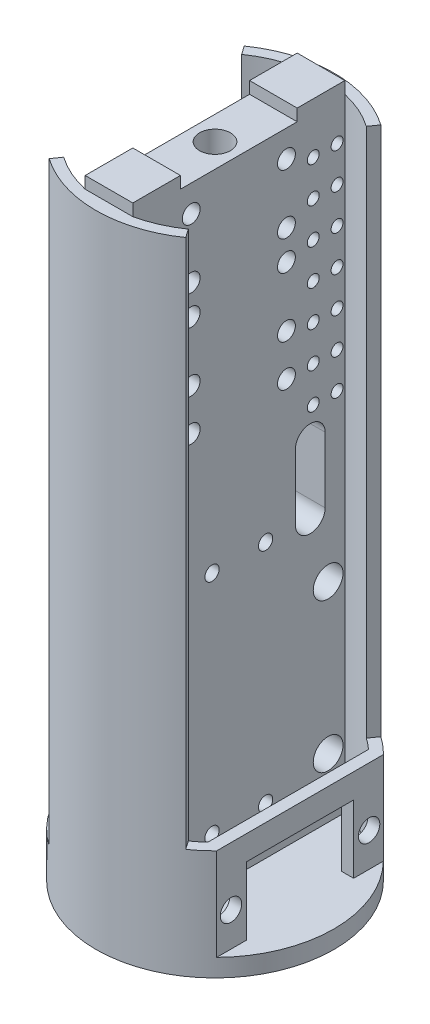
from build123d import *
from build123d.topology import SkipClean

# Parameters (mm, degrees)
SKETCH1_R            = 25.4
SKETCH1_R_2          = 3.302
BOTTOM_PLATE_DEPTH   = 3.81
LIP_START            = 5.715
SKETCH1_4_R          = 3.302
LIP_DEPTH            = 5.715
BOSS_EXTRUDE1_START  = 127
SKETCH2_R            = 3.302
BOSS_EXTRUDE1_DEPTH  = 127
SKETCH3_R            = 3.175
SKETCH3_R_2          = 1.524
SKETCH3_R_3          = 1.905
SKETCH3_R_4          = 1.27
MOUNTING_HOLES_DEPTH = 10.16
SKETCH4_W            = 10.16
SKETCH4_H            = 10.16
NOTCHES_DEPTH        = 2.54
SWITCH_FACE_START    = 13.97
SWITCH_FACE_DEPTH    = 13.97
SKETCH8_R            = 2.286
SKETCH8_W            = 22.86
SKETCH8_H            = 14.478
SWITCH_MOUNT_DEPTH   = 6.35
INDICATOR_CUT_START  = -43.539228
SKETCH8_3_R          = 2.032
INDICATOR_CUT_DEPTH  = 12.7


with BuildPart() as part:
    # Sketch1 → bottom_plate (new body)
    with BuildSketch(Plane(origin=(0, 0, 0), x_dir=(1, 0, 0), z_dir=(0, 1, 0))):
        with Locations(Location((0, 0, 0), (0, 0, 270))):
            Circle(SKETCH1_R)
        with Locations(Location((0, 0, 0), (0, 0, 270))):
            Circle(SKETCH1_R_2, mode=Mode.SUBTRACT)
    extrude(amount=-BOTTOM_PLATE_DEPTH)

    # Sketch1<4> → lip (add)
    # profile 1 of 3: a face of its own
    with BuildSketch(Plane(origin=(0, 0, 0), x_dir=(1, 0, 0), z_dir=(0, 1, 0)).offset(LIP_START)):
        with BuildLine():
            Line((18.139228208, -17.78), (18.139228208, 17.78))
            ThreePointArc((18.139228208, 17.78), (-25.4, 0), (18.139228208, -17.78))
        make_face()
        with BuildLine():
            ThreePointArc((15.599228208, -17.142362309), (-23.1775, 0), (15.599228208, 17.142362309))
            Line((15.599228208, 17.142362309), (15.599228208, -17.142362309))
        make_face(mode=Mode.SUBTRACT)
    # profile 2 of 3: a face of its own
    with BuildSketch(Plane(origin=(0, 0, 0), x_dir=(1, 0, 0), z_dir=(0, 1, 0)).offset(LIP_START)):
        with BuildLine():
            ThreePointArc((5.08, 22.613936107), (0, 23.1775), (-5.08, 22.613936107))
            Line((-5.08, 22.613936107), (-5.08, 19.05))
            Line((-5.08, 19.05), (-5.08, -19.05))
            Line((-5.08, -19.05), (-5.08, -22.613936107))
            ThreePointArc((-5.08, -22.613936107), (0, -23.1775), (5.08, -22.613936107))
            Line((5.08, -22.613936107), (5.08, 22.613936107))
        make_face()
        with Locations(Location((0, 0, 0), (0, 0, 270))):
            Circle(SKETCH1_4_R, mode=Mode.SUBTRACT)
    # profile 3 of 3: a face of its own
    with BuildSketch(Plane(origin=(0, 0, 0), x_dir=(1, 0, 0), z_dir=(0, 1, 0)).offset(LIP_START)):
        with BuildLine():
            Line((-5.08, 19.05), (-5.08, 22.613936107))
            ThreePointArc((-5.08, 22.613936107), (-12.950295211, 19.222027994), (-19.05, 13.202045533))
            Line((-19.05, 13.202045533), (-19.05, -13.202045533))
            ThreePointArc((-19.05, -13.202045533), (-12.950295211, -19.222027994), (-5.08, -22.613936107))
            Line((-5.08, -22.613936107), (-5.08, -19.05))
            Line((-5.08, -19.05), (-12.7, -19.05))
            Line((-12.7, -19.05), (-12.7, 19.05))
            Line((-12.7, 19.05), (-5.08, 19.05))
        make_face()
    extrude(amount=-LIP_DEPTH)

    # Sketch2 → Boss-Extrude1 (add)
    with SkipClean():  # the faces are left unmerged after this step: merging them gives an invalid solid
        with BuildSketch(Plane(origin=(0, 5.715, 0), x_dir=(1, 0, 0), z_dir=(0, 1, 0)).offset(BOSS_EXTRUDE1_START)):
            with BuildLine():
                Line((5.08, 22.613936107), (5.08, -22.613936107))
                ThreePointArc((5.08, -22.613936107), (9.364414568, -21.201515183), (13.294067854, -18.985896507))
                Line((13.294067854, -18.985896507), (14.568841483, -20.806461925))
                ThreePointArc((14.568841483, -20.806461925), (0, -25.4), (-14.568841483, -20.806461925))
                Line((-14.568841483, -20.806461925), (-13.294067854, -18.985896507))
                ThreePointArc((-13.294067854, -18.985896507), (-9.364414568, -21.201515183), (-5.08, -22.613936107))
                Line((-5.08, -22.613936107), (-5.08, 22.613936107))
                ThreePointArc((-5.08, 22.613936107), (-9.364414568, 21.201515183), (-13.294067854, 18.985896507))
                Line((-13.294067854, 18.985896507), (-14.568841483, 20.806461925))
                ThreePointArc((-14.568841483, 20.806461925), (0, 25.4), (14.568841483, 20.806461925))
                Line((14.568841483, 20.806461925), (13.294067854, 18.985896507))
                ThreePointArc((13.294067854, 18.985896507), (9.364414568, 21.201515183), (5.08, 22.613936107))
            make_face()
            with Locations(Location((0, 0, 0), (0, 0, 270))):
                Circle(SKETCH2_R, mode=Mode.SUBTRACT)
        extrude(amount=-BOSS_EXTRUDE1_DEPTH)

    # Sketch3 → mounting_holes (cut)
    with SkipClean():  # the faces are left unmerged after this step: merging them gives an invalid solid
        with BuildSketch(Plane.ZY.offset(5.08)):
            with BuildLine():
                Line((18.415, 58.42), (18.415, 72.39))
                ThreePointArc((18.415, 72.39), (15.24, 75.565), (12.065, 72.39))
                Line((12.065, 72.39), (12.065, 58.42))
                ThreePointArc((12.065, 58.42), (15.24, 55.245), (18.415, 58.42))
            make_face()
            with BuildLine():
                Line((-12.065, 58.42), (-12.065, 72.39))
                ThreePointArc((-12.065, 72.39), (-15.24, 75.565), (-18.415, 72.39))
                Line((-18.415, 72.39), (-18.415, 58.42))
                ThreePointArc((-18.415, 58.42), (-15.24, 55.245), (-12.065, 58.42))
            make_face()
            with Locations((-19.05, 44.45)):
                Circle(SKETCH3_R)
            with Locations((19.05, 44.45)):
                Circle(SKETCH3_R)
            with Locations((-19.05, 12.7)):
                Circle(SKETCH3_R)
            with Locations((19.05, 12.7)):
                Circle(SKETCH3_R)
            with Locations((-5.715, 58.42)):
                Circle(SKETCH3_R_2)
            with Locations((5.715, 58.42)):
                Circle(SKETCH3_R_2)
            with Locations((-5.715, 10.16)):
                Circle(SKETCH3_R_2)
            with Locations((5.715, 10.16)):
                Circle(SKETCH3_R_2)
            with Locations((10.16, 86.36)):
                Circle(SKETCH3_R_3)
            with Locations((-10.16, 86.36)):
                Circle(SKETCH3_R_3)
            with Locations((-10.16, 107.95)):
                Circle(SKETCH3_R_3)
            with Locations((-10.16, 95.25)):
                Circle(SKETCH3_R_3)
            with Locations((10.16, 107.95)):
                Circle(SKETCH3_R_3)
            with Locations((10.16, 95.25)):
                Circle(SKETCH3_R_3)
            with Locations((-10.16, 127)):
                Circle(SKETCH3_R_3)
            with Locations((-10.16, 114.3)):
                Circle(SKETCH3_R_3)
            with Locations((10.16, 114.3)):
                Circle(SKETCH3_R_3)
            with Locations((10.16, 127)):
                Circle(SKETCH3_R_3)
            with Locations((-20.955, 78.74)):
                Circle(SKETCH3_R_4)
            with Locations((-15.875, 78.74)):
                Circle(SKETCH3_R_4)
            with Locations((-20.955, 86.36)):
                Circle(SKETCH3_R_4)
            with Locations((-15.875, 86.36)):
                Circle(SKETCH3_R_4)
            with Locations((-20.955, 93.98)):
                Circle(SKETCH3_R_4)
            with Locations((-15.875, 93.98)):
                Circle(SKETCH3_R_4)
            with Locations((-20.955, 101.6)):
                Circle(SKETCH3_R_4)
            with Locations((-15.875, 101.6)):
                Circle(SKETCH3_R_4)
            with Locations((-20.955, 109.22)):
                Circle(SKETCH3_R_4)
            with Locations((-15.875, 109.22)):
                Circle(SKETCH3_R_4)
            with Locations((-20.955, 116.84)):
                Circle(SKETCH3_R_4)
            with Locations((-15.875, 116.84)):
                Circle(SKETCH3_R_4)
            with Locations((-20.955, 124.46)):
                Circle(SKETCH3_R_4)
            with Locations((-15.875, 124.46)):
                Circle(SKETCH3_R_4)
            with Locations((20.955, 124.46)):
                Circle(SKETCH3_R_4)
            with Locations((15.875, 124.46)):
                Circle(SKETCH3_R_4)
            with Locations((15.875, 116.84)):
                Circle(SKETCH3_R_4)
            with Locations((20.955, 116.84)):
                Circle(SKETCH3_R_4)
            with Locations((20.955, 109.22)):
                Circle(SKETCH3_R_4)
            with Locations((15.875, 109.22)):
                Circle(SKETCH3_R_4)
            with Locations((15.875, 101.6)):
                Circle(SKETCH3_R_4)
            with Locations((20.955, 101.6)):
                Circle(SKETCH3_R_4)
            with Locations((20.955, 93.98)):
                Circle(SKETCH3_R_4)
            with Locations((15.875, 93.98)):
                Circle(SKETCH3_R_4)
            with Locations((20.955, 86.36)):
                Circle(SKETCH3_R_4)
            with Locations((15.875, 86.36)):
                Circle(SKETCH3_R_4)
            with Locations((20.955, 78.74)):
                Circle(SKETCH3_R_4)
            with Locations((15.875, 78.74)):
                Circle(SKETCH3_R_4)
        extrude(amount=-MOUNTING_HOLES_DEPTH, mode=Mode.SUBTRACT)

    # Sketch4 → notches (add)
    with SkipClean():  # the faces are left unmerged after this step: merging them gives an invalid solid
        with BuildSketch(Plane(origin=(0, 132.715, 0), x_dir=(1, 0, 0), z_dir=(0, 1, 0))):
            with Locations((0, 17.533936107)):
                Rectangle(SKETCH4_W, SKETCH4_H)
            with Locations((0, -17.533936107)):
                Rectangle(SKETCH4_W, SKETCH4_H)
        extrude(amount=NOTCHES_DEPTH)

    # Sketch7 → switch_face (add)
    with SkipClean():  # the faces are left unmerged after this step: merging them gives an invalid solid
        with BuildSketch(Plane(origin=(0, 5.715, 0), x_dir=(1, 0, 0), z_dir=(0, 1, 0)).offset(SWITCH_FACE_START)):
            with BuildLine():
                Line((13.294067854, -18.985896507), (14.568841483, -20.806461925))
                ThreePointArc((14.568841483, -20.806461925), (16.4238949, -19.375646475), (18.139228208, -17.78))
                Line((18.139228208, -17.78), (18.139228208, 17.78))
                ThreePointArc((18.139228208, 17.78), (16.4238949, 19.375646475), (14.568841483, 20.806461925))
                Line((14.568841483, 20.806461925), (13.294067854, 18.985896507))
                ThreePointArc((13.294067854, 18.985896507), (14.476024797, 18.100862199), (15.599228208, 17.142362309))
                Line((15.599228208, 17.142362309), (15.599228208, -17.142362309))
                ThreePointArc((15.599228208, -17.142362309), (14.476024797, -18.100862199), (13.294067854, -18.985896507))
            make_face()
        extrude(amount=-SWITCH_FACE_DEPTH)

    # Sketch8 → switch_mount (cut)
    with SkipClean():  # the faces are left unmerged after this step: merging them gives an invalid solid
        with BuildSketch(Plane(origin=(18.139228208, 0, 0), x_dir=(0, 0, -1), z_dir=(1, 0, 0))):
            with Locations((14.732, 7.239)):
                Circle(SKETCH8_R)
            with Locations((-14.732, 7.239)):
                Circle(SKETCH8_R)
            with Locations((0, 7.239)):
                Rectangle(SKETCH8_W, SKETCH8_H)
        extrude(amount=-SWITCH_MOUNT_DEPTH, mode=Mode.SUBTRACT)

    # Sketch8<3> → indicator_cut (cut)
    with SkipClean():  # the faces are left unmerged after this step: merging them gives an invalid solid
        with BuildSketch(Plane(origin=(18.139228208, 0, 0), x_dir=(0, 0, -1), z_dir=(1, 0, 0)).offset(INDICATOR_CUT_START)):
            with Locations(Location((0, 2.032, 0), (0, 0, 270))):
                Circle(SKETCH8_3_R)
        extrude(amount=INDICATOR_CUT_DEPTH, mode=Mode.SUBTRACT)


solid = part.part
